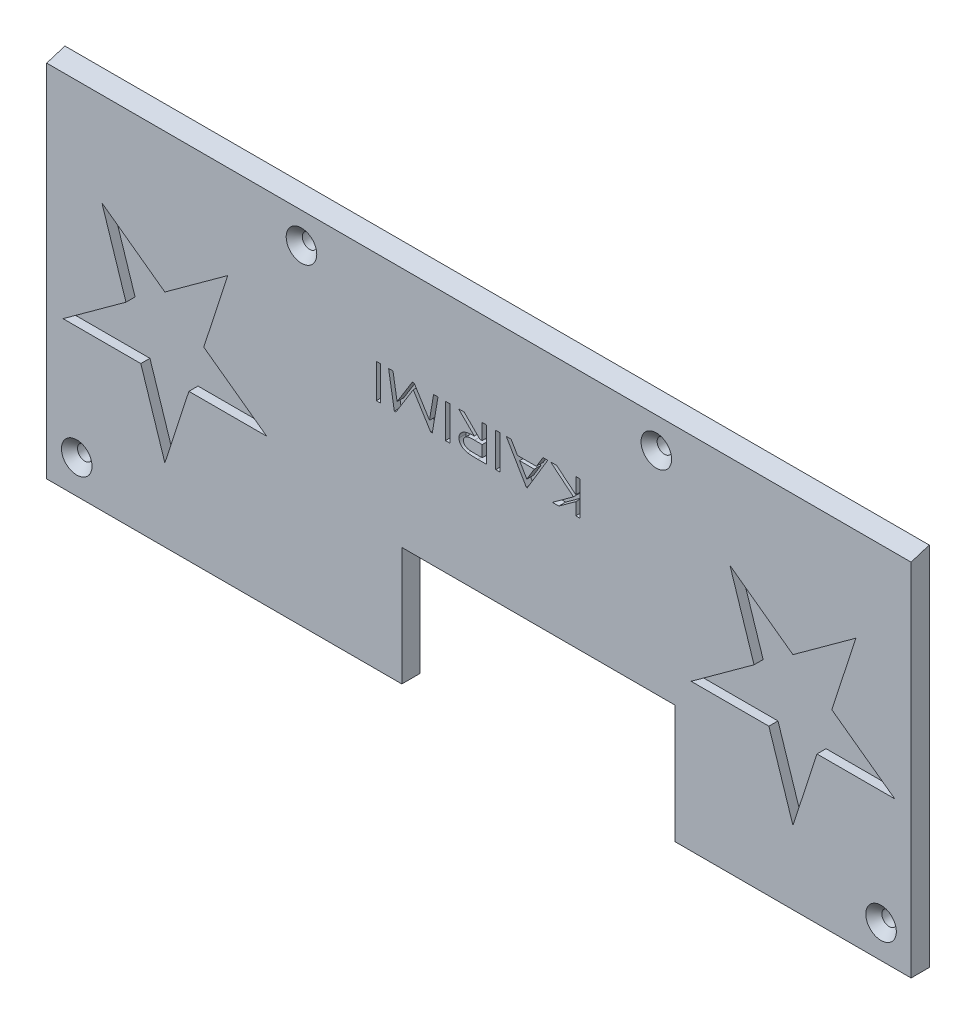
from build123d import *

# Parameters (mm, degrees)
CROQUIS1_R                      = 1.625
SALIENTE_EXTRUIR1_DEPTH         = 4
CORTAR_EXTRUIR1_START           = -190
CORTAR_EXTRUIR1_DEPTH           = 190
CROQUIS4_R                      = 3.35997123
CORTAR_EXTRUIR2_DEPTH           = 1.8
CORTAR_EXTRUIR2_DRAFT           = -44
CORTAR_EXTRUIR2_PROFILE_2_DEPTH = 1.8
CORTAR_EXTRUIR2_PROFILE_2_DRAFT = -44
CORTAR_EXTRUIR2_PROFILE_3_DEPTH = 1.8
CORTAR_EXTRUIR2_PROFILE_3_DRAFT = -44
CORTAR_EXTRUIR2_PROFILE_4_DEPTH = 1.8
CORTAR_EXTRUIR2_PROFILE_4_DRAFT = -44
CORTAR_EXTRUIR3_DEPTH           = 2
CROQUIS9_W                      = 0.961538462
CROQUIS9_H                      = 7.5
CORTAR_EXTRUIR5_DEPTH           = 1.5


with BuildPart() as part:
    # Croquis1 → Saliente-Extruir1 (new body)
    with BuildSketch(Plane.XY):
        Polygon((-32.320991683, -51.284123552), (-32.320991683, 29.135238548), (157.679008317, 29.135238548), (157.679008317, -51.284123552), (105.737585684, -51.284123552), (105.737585684, -25.284123552), (45.737585684, -25.284123552), (45.737585684, -51.284123552), align=None)
        with Locations((23.679008317, 21.135238548)):
            Circle(CROQUIS1_R, mode=Mode.SUBTRACT)
        with Locations((101.679008317, 21.135238548)):
            Circle(CROQUIS1_R, mode=Mode.SUBTRACT)
        with Locations((-25.720991683, -43.884123552)):
            Circle(CROQUIS1_R, mode=Mode.SUBTRACT)
        with Locations((151.079008317, -44.084123552)):
            Circle(CROQUIS1_R, mode=Mode.SUBTRACT)
    extrude(amount=SALIENTE_EXTRUIR1_DEPTH)

    # Croquis3 → Cortar-Extruir1 (cut)
    with BuildSketch(Plane(origin=(157.679008317, 0, 0), x_dir=(0, 0, -1), z_dir=(1, 0, 0)).offset(CORTAR_EXTRUIR1_START)):
        Polygon((-4, 29.135238548), (0, 29.135238548), (-4, 27.880003721), align=None)
    extrude(amount=CORTAR_EXTRUIR1_DEPTH, mode=Mode.SUBTRACT)


with BuildPart() as cortar_extruir2_tool:
    # Croquis4 → Cortar-Extruir2 (with draft: the straight prism first)
    with BuildSketch(Plane.XY.offset(4)):
        with Locations((23.679008317, 21.135238548)):
            Circle(CROQUIS4_R)
    extrude(amount=-CORTAR_EXTRUIR2_DEPTH)
    # Cortar-Extruir2: the draft: its side faces are tilted about the plane it starts from
    cortar_extruir2_sides = [cortar_extruir2_tool.faces().sort_by_distance(p)[0] for p in [
        (20.319037087, 21.135238548, 3.1),
    ]]
    draft(cortar_extruir2_sides, Plane.XY.offset(4), CORTAR_EXTRUIR2_DRAFT)


with BuildPart() as part_1:
    add(part.part)

    # Cortar-Extruir2: cut by cortar_extruir2_tool
    add(cortar_extruir2_tool.part, mode=Mode.SUBTRACT)


with BuildPart() as cortar_extruir2_profile_2_tool:
    # Croquis4 → Cortar-Extruir2 profile 2 (with draft: the straight prism first)
    with BuildSketch(Plane.XY.offset(4)):
        with Locations((101.679008317, 21.135238548)):
            Circle(CROQUIS4_R)
    extrude(amount=-CORTAR_EXTRUIR2_PROFILE_2_DEPTH)
    # Cortar-Extruir2 profile 2: the draft: its side faces are tilted about the plane it starts from
    cortar_extruir2_profile_2_sides = [cortar_extruir2_profile_2_tool.faces().sort_by_distance(p)[0] for p in [
        (98.319037087, 21.135238548, 3.1),
    ]]
    draft(cortar_extruir2_profile_2_sides, Plane.XY.offset(4), CORTAR_EXTRUIR2_PROFILE_2_DRAFT)


with BuildPart() as part_2:
    add(part_1.part)

    # Cortar-Extruir2 profile 2: cut by cortar_extruir2_profile_2_tool
    add(cortar_extruir2_profile_2_tool.part, mode=Mode.SUBTRACT)


with BuildPart() as cortar_extruir2_profile_3_tool:
    # Croquis4 → Cortar-Extruir2 profile 3 (with draft: the straight prism first)
    with BuildSketch(Plane.XY.offset(4)):
        with Locations((-25.720991683, -43.884123552)):
            Circle(CROQUIS4_R)
    extrude(amount=-CORTAR_EXTRUIR2_PROFILE_3_DEPTH)
    # Cortar-Extruir2 profile 3: the draft: its side faces are tilted about the plane it starts from
    cortar_extruir2_profile_3_sides = [cortar_extruir2_profile_3_tool.faces().sort_by_distance(p)[0] for p in [
        (-29.080962913, -43.884123552, 3.1),
    ]]
    draft(cortar_extruir2_profile_3_sides, Plane.XY.offset(4), CORTAR_EXTRUIR2_PROFILE_3_DRAFT)


with BuildPart() as part_3:
    add(part_2.part)

    # Cortar-Extruir2 profile 3: cut by cortar_extruir2_profile_3_tool
    add(cortar_extruir2_profile_3_tool.part, mode=Mode.SUBTRACT)


with BuildPart() as cortar_extruir2_profile_4_tool:
    # Croquis4 → Cortar-Extruir2 profile 4 (with draft: the straight prism first)
    with BuildSketch(Plane.XY.offset(4)):
        with Locations((151.079008317, -44.084123552)):
            Circle(CROQUIS4_R)
    extrude(amount=-CORTAR_EXTRUIR2_PROFILE_4_DEPTH)
    # Cortar-Extruir2 profile 4: the draft: its side faces are tilted about the plane it starts from
    cortar_extruir2_profile_4_sides = [cortar_extruir2_profile_4_tool.faces().sort_by_distance(p)[0] for p in [
        (147.719037087, -44.084123552, 3.1),
    ]]
    draft(cortar_extruir2_profile_4_sides, Plane.XY.offset(4), CORTAR_EXTRUIR2_PROFILE_4_DRAFT)


with BuildPart() as part_4:
    add(part_3.part)

    # Cortar-Extruir2 profile 4: cut by cortar_extruir2_profile_4_tool
    add(cortar_extruir2_profile_4_tool.part, mode=Mode.SUBTRACT)

    # Croquis6 → Cortar-Extruir3 (cut)
    with BuildSketch(Plane.XY.offset(4)):
        Polygon((16.032465101, -18.974654774), (-1.066430914, -18.974654774), (-6.350280368, -35.236671251), (-11.634129822, -18.974654774), (-28.733025837, -18.974654774), (-14.899728375, -8.924175866), (-20.183577829, 7.337840611), (-6.350280368, -2.712638297), (7.483017094, 7.337840611), (2.19916764, -8.924175866), align=None)
        Polygon((109.325551533, -18.974654774), (126.424447548, -18.974654774), (131.708297002, -35.236671251), (136.992146456, -18.974654774), (154.091042471, -18.974654774), (140.25774501, -8.924175866), (145.541594464, 7.337840611), (131.708297002, -2.712638297), (117.874999541, 7.337840611), (123.158848995, -8.924175866), align=None)
    extrude(amount=-CORTAR_EXTRUIR3_DEPTH, mode=Mode.SUBTRACT)

    # Croquis9 → Cortar-Extruir5 (cut)
    # profile 1 of 7: a face of its own
    with BuildSketch(Plane.XY.offset(4)):
        Polygon((84.938623702, -0.162159389), (83.97708524, -0.162159389), (83.97708524, 2.546674746), (80.24661649, -0.162159389), (78.832854471, -0.162159389), (83.464765529, 3.203225226), (78.448239086, 7.337840611), (79.771856875, 7.337840611), (83.97708524, 3.871794938), (83.97708524, 7.337840611), (84.938623702, 7.337840611), align=None)
    # profile 2 of 7: a face of its own
    with BuildSketch(Plane.XY.offset(4)):
        Polygon((73.111700625, -0.162159389), (68.688623702, 7.337840611), (69.747818413, 7.337840611), (71.166087644, 4.933994457), (75.309717452, 4.933994457), (76.759537163, 7.337840611), (77.823239086, 7.337840611), (73.304008317, -0.162159389), align=None)
        Polygon((73.21536649, 1.457431957), (74.846977067, 4.164763688), (71.618311202, 4.164763688), align=None, mode=Mode.SUBTRACT)
    # profile 3 of 7: a face of its own
    with BuildSketch(Plane.XY.offset(4)):
        with Locations((66.861700625, 3.587840611)):
            Rectangle(CROQUIS9_W, CROQUIS9_H)
    # profile 4 of 7: a face of its own
    with BuildSketch(Plane.XY.offset(4)):
        with BuildLine():
            Line((64.361700625, -0.162159389), (62.432614086, -0.162159389))
            add(Edge.make_bspline(
                [(62.432614086, -0.162159389), (62.303407857, -0.161829936), (62.056004322, -0.161199101), (61.701380518, -0.157593434), (61.379408986, -0.147395372), (61.089802811, -0.138594846), (60.832957985, -0.122524062), (60.608382947, -0.107262614), (60.416359573, -0.087004293), (60.299642276, -0.06843303), (60.24661649, -0.059995928)],
                knots=[0, 0, 0, 0, 1.415751681, 2.71087525, 3.885633551, 4.945392006, 5.885335126, 6.705178082, 7.411750013, 8, 8, 8, 8], degree=3))
            add(Edge.make_bspline(
                [(60.24661649, -0.059995928), (60.176287708, -0.046434609), (60.037576928, -0.019687366), (59.836939759, 0.036257843), (59.646354736, 0.102761484), (59.465191207, 0.179124214), (59.294103688, 0.267862518), (59.132735961, 0.367086444), (58.982105619, 0.477181944), (58.841971811, 0.596786711), (58.716597542, 0.726930123), (58.605911754, 0.864303479), (58.511163617, 1.009066491), (58.437601574, 1.163087556), (58.375263981, 1.322066158), (58.333771964, 1.489710459), (58.309818392, 1.664567276), (58.305961545, 1.783379506), (58.304008317, 1.843549746)],
                knots=[0, 0, 0, 0, 1.157691968, 2.283337632, 3.364020569, 4.419814557, 5.459210511, 6.477190408, 7.479723838, 8.473058916, 9.452300592, 10.396950777, 11.322316779, 12.24213949, 13.151964026, 14.078922895, 15.027106307, 16, 16, 16, 16], degree=3))
            add(Edge.make_bspline(
                [(58.304008317, 1.843549746), (58.305091786, 1.894193695), (58.307233563, 1.994305563), (58.326423676, 2.141861151), (58.353980579, 2.284876692), (58.39549308, 2.422930299), (58.44745429, 2.556502857), (58.513219778, 2.685284656), (58.589509979, 2.809405247), (58.676822774, 2.929058118), (58.776602841, 3.04093505), (58.884566714, 3.148428384), (59.003880288, 3.24768771), (59.133254395, 3.339146066), (59.272547378, 3.423510414), (59.421274842, 3.50192944), (59.580656173, 3.571958158), (59.750424189, 3.636018975), (59.934268605, 3.69139676), (60.133100327, 3.741243648), (60.349126643, 3.780614055), (60.580514781, 3.815583328), (60.829148914, 3.842258394), (61.094233729, 3.861356634), (61.375810546, 3.873582923), (61.568718995, 3.875378875), (61.667890529, 3.876302149)],
                knots=[0, 0, 0, 0, 0.82629536, 1.63340285, 2.425382263, 3.201336329, 3.983124717, 4.761829792, 5.558184815, 6.35935043, 7.176046838, 8.002665633, 8.844186878, 9.706107795, 10.586553567, 11.500699361, 12.448580803, 13.426410186, 14.460764388, 15.580971395, 16.77061285, 18.043484787, 19.400318222, 20.851143476, 22.381216936, 24, 24, 24, 24], degree=3))
            Line((61.667890529, 3.876302149), (58.207854471, 7.337840611))
            Line((58.207854471, 7.337840611), (59.430811202, 7.337840611))
            Line((59.430811202, 7.337840611), (62.890847259, 3.876302149))
            Line((62.890847259, 3.876302149), (63.400162163, 3.876302149))
            Line((63.400162163, 3.876302149), (63.400162163, 7.337840611))
            Line((63.400162163, 7.337840611), (64.361700625, 7.337840611))
            Line((64.361700625, 7.337840611), (64.361700625, -0.162159389))
        make_face()
        with BuildLine():
            Line((63.400162163, 0.60707138), (63.400162163, 3.10707138))
            Line((63.400162163, 3.10707138), (61.712962644, 3.117588207))
            add(Edge.make_bspline(
                [(61.712962644, 3.117588207), (61.6338262, 3.117624593), (61.48102171, 3.11769485), (61.260170178, 3.109105998), (61.055229731, 3.099416115), (60.865838556, 3.084387818), (60.692378793, 3.065434605), (60.534983254, 3.041372826), (60.393457337, 3.013276714), (60.228708832, 2.970150308), (60.04308286, 2.905086825), (59.845073139, 2.802592369), (59.671455393, 2.679607959), (59.526919773, 2.535743204), (59.408781872, 2.378204093), (59.32775206, 2.207226521), (59.274453943, 2.028014983), (59.268539248, 1.904525416), (59.265546779, 1.842047342)],
                knots=[0, 0, 0, 0, 1.231241804, 2.377403736, 3.438588451, 4.423532574, 5.333122879, 6.153078988, 6.900388758, 7.57703744, 8.802049324, 9.952204265, 11.035615897, 12.099087035, 13.113730954, 14.082638441, 15.029933775, 16, 16, 16, 16], degree=3))
            add(Edge.make_bspline(
                [(59.265546779, 1.842047342), (59.268716736, 1.78162656), (59.275033974, 1.661217199), (59.326660493, 1.485205192), (59.413536844, 1.319765548), (59.52862314, 1.163619228), (59.673346138, 1.024962204), (59.840039394, 0.905484395), (60.027181277, 0.807486158), (60.199202974, 0.742600317), (60.354080103, 0.704099078), (60.489215667, 0.676455153), (60.642999865, 0.656896215), (60.81430402, 0.638812614), (61.003643568, 0.623698235), (61.210563803, 0.613598768), (61.435480972, 0.607489486), (61.59126372, 0.607214564), (61.67239774, 0.60707138)],
                knots=[0, 0, 0, 0, 0.958272772, 1.909690835, 2.884192254, 3.91323511, 4.976135083, 6.053102071, 7.159410583, 8.321911079, 8.96225367, 9.69213132, 10.510867191, 11.422434135, 12.427570329, 13.526393913, 14.711708402, 16, 16, 16, 16], degree=3))
            Line((61.67239774, 0.60707138), (63.400162163, 0.60707138))
        make_face(mode=Mode.SUBTRACT)
    # profile 5 of 7: a face of its own
    with BuildSketch(Plane.XY.offset(4)):
        with Locations((55.804008317, 3.587840611)):
            Rectangle(CROQUIS9_W, CROQUIS9_H)
    # profile 6 of 7: a face of its own
    with BuildSketch(Plane.XY.offset(4)):
        Polygon((53.688623702, 7.337840611), (52.429609279, -0.162159389), (52.088563606, -0.162159389), (48.255931394, 5.991686765), (44.438323221, -0.162159389), (44.085258317, -0.162159389), (42.823239086, 7.337840611), (43.792289567, 7.337840611), (44.698239086, 1.953225226), (48.038082836, 7.337840611), (48.458755913, 7.337840611), (51.813623702, 1.953225226), (52.718070817, 7.337840611), align=None)
    # profile 7 of 7: a face of its own
    with BuildSketch(Plane.XY.offset(4)):
        with Locations((40.611700625, 3.587840611)):
            Rectangle(CROQUIS9_W, CROQUIS9_H)
    extrude(amount=-CORTAR_EXTRUIR5_DEPTH, mode=Mode.SUBTRACT)


solid = part_4.part
